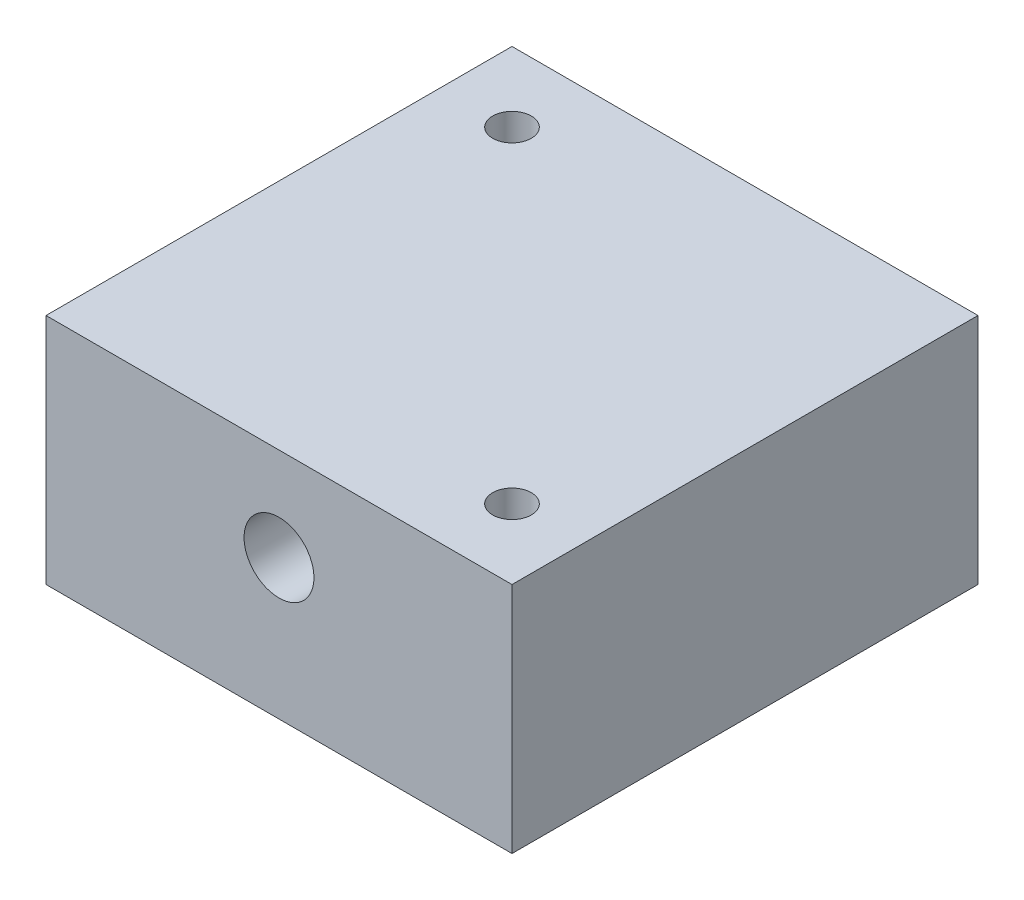
from build123d import *

# Parameters (mm, degrees)
SKIZZE1_W                                           = 100
SKIZZE1_H                                           = 50
AUFSATZ_LINEAR_AUSTRAGEN1_DEPTH                     = 100
KERNLOCH_F_R_M8_HELICOIL1_D                         = 8.3
KERNLOCH_F_R_M8_HELICOIL1_DEPTH                     = 20
KERNLOCH_F_R_M8_HELICOIL1_TIP                       = 2.493571569
STIRNSENKUNG_F_R_M8_SENKSCHRAUBE_KOPF_B_D           = 9
STIRNSENKUNG_F_R_M8_SENKSCHRAUBE_KOPF_B_CBORE_D     = 15
STIRNSENKUNG_F_R_M8_SENKSCHRAUBE_KOPF_B_CBORE_DEPTH = 116
KERNLOCH_F_R_M8_HELICOIL2_D                         = 8.3
KERNLOCH_F_R_M8_HELICOIL2_DEPTH                     = 20
KERNLOCH_F_R_M8_HELICOIL2_TIP                       = 2.493571569


with BuildPart() as part:
    # Skizze1 → Aufsatz-Linear austragen1 (new body)
    with BuildSketch(Plane.XY):
        Rectangle(SKIZZE1_W, SKIZZE1_H)
    extrude(amount=AUFSATZ_LINEAR_AUSTRAGEN1_DEPTH)

    # Kernloch für M8 Helicoil1
    with Locations(Plane(origin=(0, 25, 0), x_dir=(1, 0, 0), z_dir=(0, 1, 0))):
        with Locations((35, -85), (-35, -15)):
            Hole(KERNLOCH_F_R_M8_HELICOIL1_D / 2, depth=KERNLOCH_F_R_M8_HELICOIL1_DEPTH)
            with Locations((0, 0, -(KERNLOCH_F_R_M8_HELICOIL1_DEPTH + KERNLOCH_F_R_M8_HELICOIL1_TIP / 2))):  # 118° drill point
                Cone(0, KERNLOCH_F_R_M8_HELICOIL1_D / 2, KERNLOCH_F_R_M8_HELICOIL1_TIP, mode=Mode.SUBTRACT)

    # Stirnsenkung für M8 Senkschraube (Kopf Button)1 (through all)
    with Locations(Plane.XY.offset(100)):
        with Locations((4.444e-06, 5)):
            CounterBoreHole(STIRNSENKUNG_F_R_M8_SENKSCHRAUBE_KOPF_B_D / 2, STIRNSENKUNG_F_R_M8_SENKSCHRAUBE_KOPF_B_CBORE_D / 2, STIRNSENKUNG_F_R_M8_SENKSCHRAUBE_KOPF_B_CBORE_DEPTH)

    # Kernloch für M8 Helicoil2
    with Locations(Plane(origin=(0, 0, 0), x_dir=(-1, 0, 0), z_dir=(0, 0, -1))):
        with Locations((19.230769231, 5.769226325)):
            Hole(KERNLOCH_F_R_M8_HELICOIL2_D / 2, depth=KERNLOCH_F_R_M8_HELICOIL2_DEPTH)
            with Locations((0, 0, -(KERNLOCH_F_R_M8_HELICOIL2_DEPTH + KERNLOCH_F_R_M8_HELICOIL2_TIP / 2))):  # 118° drill point
                Cone(0, KERNLOCH_F_R_M8_HELICOIL2_D / 2, KERNLOCH_F_R_M8_HELICOIL2_TIP, mode=Mode.SUBTRACT)


solid = part.part
